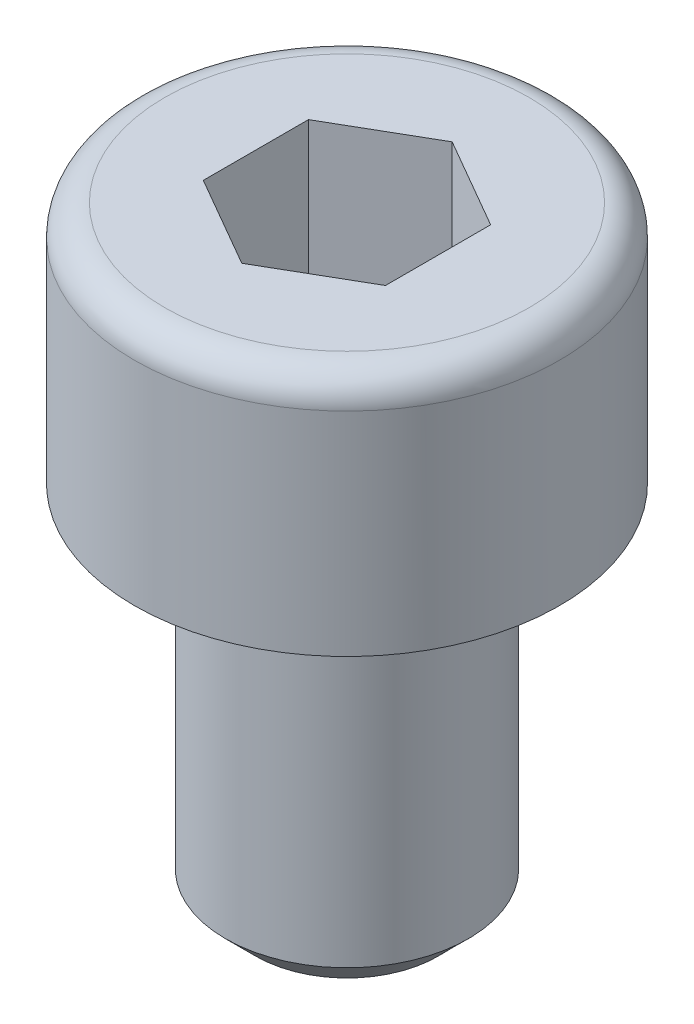
from build123d import *

# Parameters (mm, degrees)
CORTAR_EXTRUIR1_DEPTH = 3
CHAFL_N1_SIZE         = 0.5
REDONDEO1_R           = 0.5


with BuildPart() as part:
    # Croquis1 → Revolución1 (revolve)
    with BuildSketch(Plane.XY, mode=Mode.PRIVATE) as revoluci_n1_sk:
        Polygon((0, 0), (3.5, 0), (3.5, -4), (2, -4), (2, -10), (0, -10), align=None)
    revolve(revoluci_n1_sk.sketch.rotate(Axis((0, 0, 0), (0, -1, 0)), 90), axis=Axis((0, 0, 0), (0, -1, 0)))

    # Croquis2 → Cortar-Extruir1 (cut)
    with BuildSketch(Plane(origin=(0, 0, 0), x_dir=(1, 0, 0), z_dir=(0, 1, 0))):
        Polygon((1.5, 0.866025404), (0, 1.732050808), (-1.5, 0.866025404), (-1.5, -0.866025404), (0, -1.732050808), (1.5, -0.866025404), align=None)
    extrude(amount=-CORTAR_EXTRUIR1_DEPTH, mode=Mode.SUBTRACT)

    # Chaflán1
    chafl_n1_edges = [part.edges().sort_by_distance(p)[0] for p in [
        (0, -10, -2),
    ]]
    chamfer(chafl_n1_edges, length=CHAFL_N1_SIZE)

    # Redondeo1
    redondeo1_edges = [part.edges().sort_by_distance(p)[0] for p in [
        (0, 0, -3.5),
    ]]
    fillet(redondeo1_edges, radius=REDONDEO1_R)


solid = part.part
